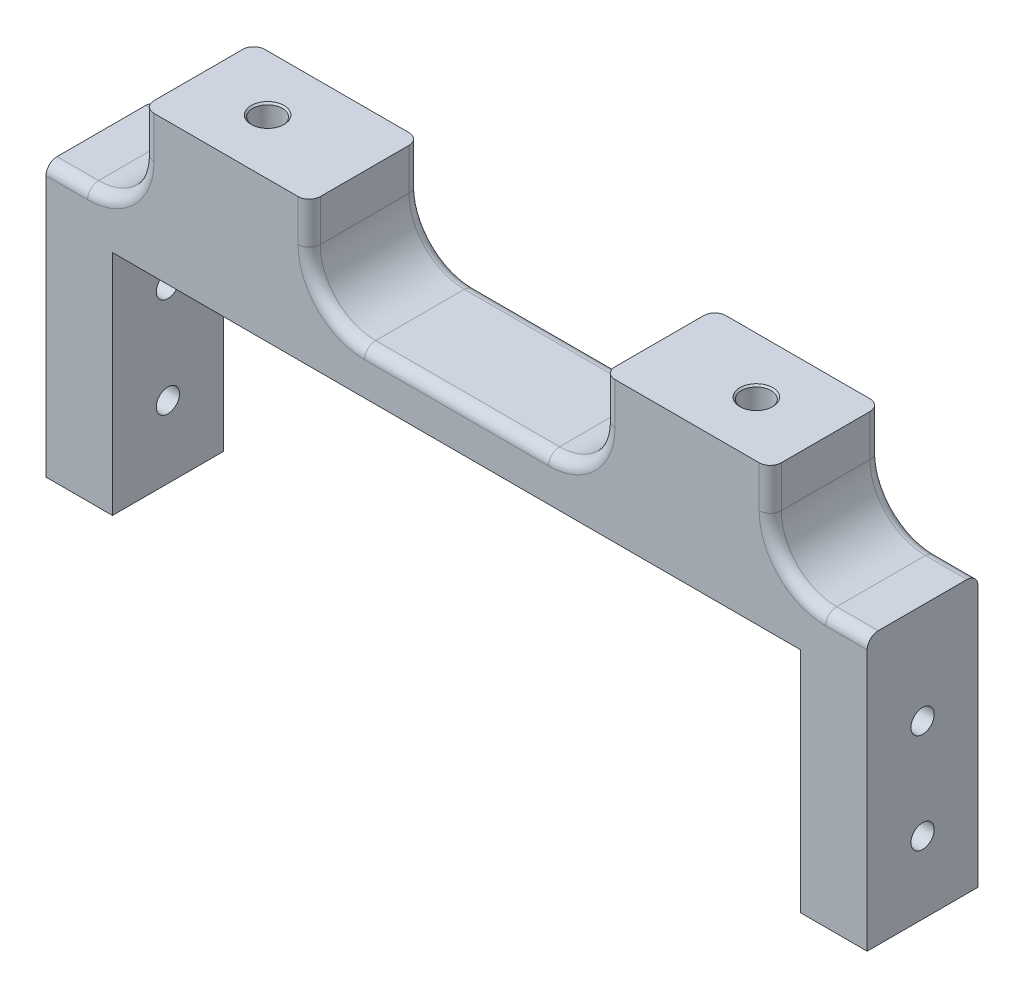
from build123d import *

# Parameters (mm, degrees)
BOSS_EXTRUDE1_DEPTH  = 20
SKETCH2_R            = 2.1
CUT_EXTRUDE1_DEPTH   = 149
SKETCH3_W            = 30
SKETCH3_H            = 17.5
BOSS_EXTRUDE2_DEPTH  = 20
FILLET1_R            = 10
FILLET1_OF_MIRROR1_R = 10
FILLET2_R            = 2
SKETCH4_R            = 2.675
CUT_EXTRUDE2_DEPTH   = 7
CHAMFER1_SIZE        = 0.3


with BuildPart() as part:
    # Sketch1 → Boss-Extrude1 (new body)
    with BuildSketch(Plane.XY):
        Polygon((-74.1, 28.55), (-74.1, -20.55), (-62.1, -20.55), (-62.1, 20.55), (62.1, 20.55), (62.1, -20.55), (74.1, -20.55), (74.1, 28.55), align=None)
    extrude(amount=BOSS_EXTRUDE1_DEPTH)

    # Sketch2 → Cut-Extrude1 (cut)
    with BuildSketch(Plane.ZY.offset(74.1)):
        with Locations((10, 10.45)):
            Circle(SKETCH2_R)
        with Locations((10, -7.55)):
            Circle(SKETCH2_R)
    extrude(amount=-CUT_EXTRUDE1_DEPTH, mode=Mode.SUBTRACT)

    # Sketch3 → Boss-Extrude2 (add)
    with BuildSketch(Plane.XY.offset(20)):
        with Locations((-41.6, 37.3)):
            Rectangle(SKETCH3_W, SKETCH3_H)
    boss_extrude2 = extrude(amount=-BOSS_EXTRUDE2_DEPTH)

    # Fillet1
    fillet1_edges = [part.edges().sort_by_distance(p)[0] for p in [
        (-26.6, 28.55, 10),
        (-56.6, 28.55, 10),
    ]]
    fillet(fillet1_edges, radius=FILLET1_R)

    # Mirror1: Boss-Extrude2 across plane
    add(boss_extrude2.mirror(Plane(origin=(0, 0, 0), x_dir=(0, 0, 1), z_dir=(1, 0, 0))))

    # Fillet1 of Mirror1
    fillet1_of_mirror1_edges = [part.edges().sort_by_distance(p)[0] for p in [
        (26.6, 28.55, 10),
        (56.6, 28.55, 10),
    ]]
    fillet(fillet1_of_mirror1_edges, radius=FILLET1_OF_MIRROR1_R)

    # Fillet2
    fillet2_edges = [part.edges().sort_by_distance(p)[0] for p in [
        (70.35, 28.55, 20),
        (-56.6, 42.3, 0),
        (-56.6, 42.3, 20),
        (-26.6, 42.3, 20),
        (-26.6, 42.3, 0),
        (-70.35, 28.55, 0),
        (-70.35, 28.55, 20),
        (-23.671067812, 31.478932188, 20),
        (-23.671067812, 31.478932188, 0),
        (-59.528932188, 31.478932188, 20),
        (-59.528932188, 31.478932188, 0),
        (56.6, 42.3, 20),
        (56.6, 42.3, 0),
        (26.6, 42.3, 20),
        (26.6, 42.3, 0),
        (0, 28.55, 0),
        (0, 28.55, 20),
        (23.671067812, 31.478932188, 20),
        (23.671067812, 31.478932188, 0),
        (59.528932188, 31.478932188, 20),
        (59.528932188, 31.478932188, 0),
        (70.35, 28.55, 0),
    ]]
    fillet(fillet2_edges, radius=FILLET2_R)

    # Sketch4 → Cut-Extrude2 (cut)
    with BuildSketch(Plane(origin=(0, 46.05, 0), x_dir=(1, 0, 0), z_dir=(0, 1, 0))):
        with Locations(Location((44.1, -10, 0), (0, 0, 180))):
            Circle(SKETCH4_R)
        with Locations(Location((-44.1, -10, 0), (0, 0, 180))):
            Circle(SKETCH4_R)
    extrude(amount=-CUT_EXTRUDE2_DEPTH, mode=Mode.SUBTRACT)

    # Chamfer1
    chamfer1_edges = [part.edges().sort_by_distance(p)[0] for p in [
        (46.775, 46.05, 10),
        (-41.425, 46.05, 10),
    ]]
    chamfer(chamfer1_edges, length=CHAMFER1_SIZE)


solid = part.part
